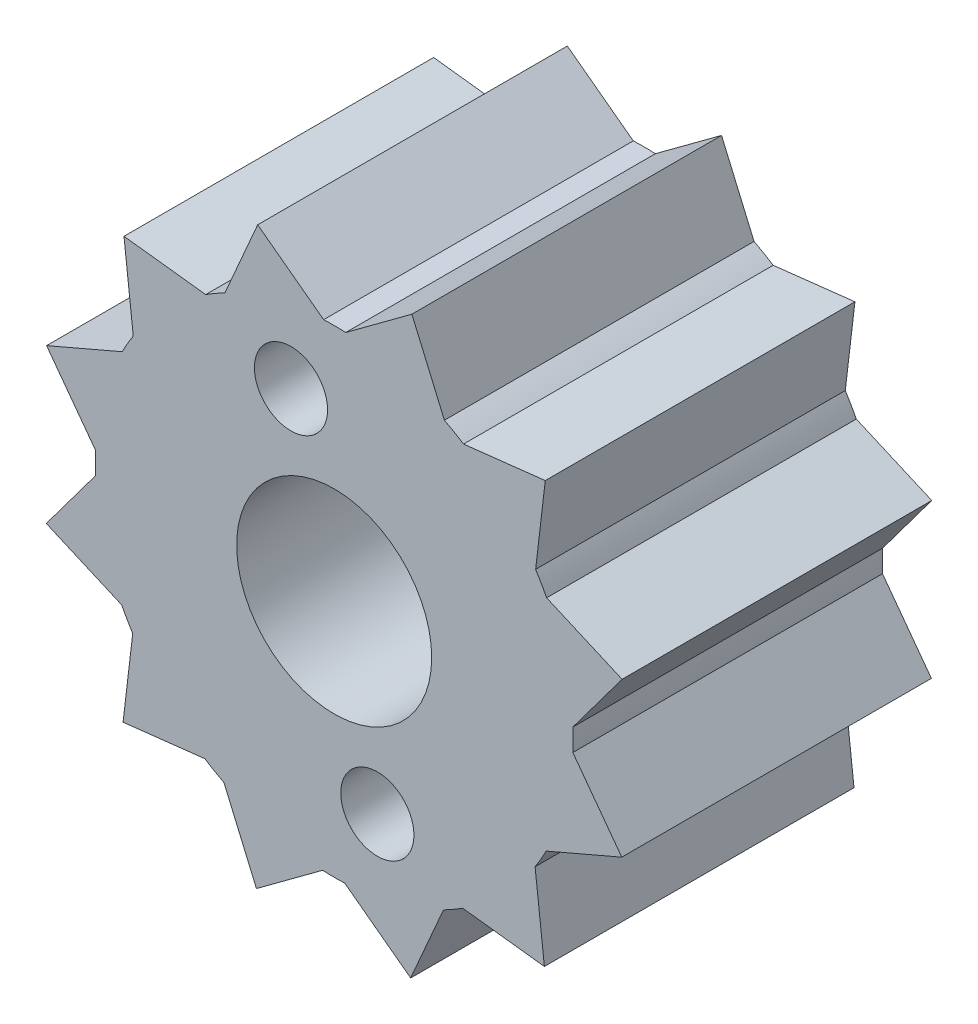
from build123d import *

# Parameters (mm, degrees)
SKETCH2_R           = 2
BOSS_EXTRUDE1_DEPTH = 6.35
SKETCH3_R           = 0.75
CUT_EXTRUDE1_DEPTH  = 11.490061241


with BuildPart() as part:
    # Sketch2 → Boss-Extrude1 (new body)
    with BuildSketch(Plane.XY):
        with BuildLine():
            Line((-5.904188549, -1.568559405), (-4.357072845, -2.241855531))
            ThreePointArc((-4.357072845, -2.241855531), (-4.248730253, -2.44096113), (-4.131295421, -2.634843097))
            Line((-4.131295421, -2.634843097), (-4.328897569, -4.310506566))
            Line((-4.328897569, -4.310506566), (-2.652408005, -4.120040264))
            ThreePointArc((-2.652408005, -4.120040264), (-2.459027768, -4.238299475), (-2.260385237, -4.347488767))
            Line((-2.260385237, -4.347488767), (-1.593681982, -5.897456974))
            Line((-1.593681982, -5.897456974), (-0.237032582, -4.894263536))
            ThreePointArc((-0.237032582, -4.894263536), (-0.010430778, -4.899988898), (0.216193347, -4.895228333))
            Line((0.216193347, -4.895228333), (1.568559405, -5.904188549))
            Line((1.568559405, -5.904188549), (2.241855531, -4.357072845))
            ThreePointArc((2.241855531, -4.357072845), (2.44096113, -4.248730253), (2.634843097, -4.131295421))
            Line((2.634843097, -4.131295421), (4.310506566, -4.328897569))
            Line((4.310506566, -4.328897569), (4.120040264, -2.652408005))
            ThreePointArc((4.120040264, -2.652408005), (4.238299475, -2.459027768), (4.347488767, -2.260385237))
            Line((4.347488767, -2.260385237), (5.897456974, -1.593681982))
            Line((5.897456974, -1.593681982), (4.894263536, -0.237032582))
            ThreePointArc((4.894263536, -0.237032582), (4.899988898, -0.010430778), (4.895228333, 0.216193347))
            Line((4.895228333, 0.216193347), (5.904188549, 1.568559405))
            Line((5.904188549, 1.568559405), (4.357072845, 2.241855531))
            ThreePointArc((4.357072845, 2.241855531), (4.248730253, 2.44096113), (4.131295421, 2.634843097))
            Line((4.131295421, 2.634843097), (4.328897569, 4.310506566))
            Line((4.328897569, 4.310506566), (2.652408005, 4.120040264))
            ThreePointArc((2.652408005, 4.120040264), (2.459027768, 4.238299475), (2.260385237, 4.347488767))
            Line((2.260385237, 4.347488767), (1.593681982, 5.897456974))
            Line((1.593681982, 5.897456974), (0.237032582, 4.894263536))
            ThreePointArc((0.237032582, 4.894263536), (0.010430778, 4.899988898), (-0.216193347, 4.895228333))
            Line((-0.216193347, 4.895228333), (-1.568559405, 5.904188549))
            Line((-1.568559405, 5.904188549), (-2.241855531, 4.357072845))
            ThreePointArc((-2.241855531, 4.357072845), (-2.44096113, 4.248730253), (-2.634843097, 4.131295421))
            Line((-2.634843097, 4.131295421), (-4.310506566, 4.328897569))
            Line((-4.310506566, 4.328897569), (-4.120040264, 2.652408005))
            ThreePointArc((-4.120040264, 2.652408005), (-4.238299475, 2.459027768), (-4.347488767, 2.260385237))
            Line((-4.347488767, 2.260385237), (-5.897456974, 1.593681982))
            Line((-5.897456974, 1.593681982), (-4.894263536, 0.237032582))
            ThreePointArc((-4.894263536, 0.237032582), (-4.899988898, 0.010430778), (-4.895228333, -0.216193347))
            Line((-4.895228333, -0.216193347), (-5.904188549, -1.568559405))
        make_face()
        Circle(SKETCH2_R, mode=Mode.SUBTRACT)
    extrude(amount=BOSS_EXTRUDE1_DEPTH)

    # Sketch3 → Cut-Extrude1 (cut, through all)
    with BuildSketch(Plane.XY.offset(6.35)):
        with Locations((-0.885829808, 3.334337348)):
            Circle(SKETCH3_R)
        with Locations((0.885829808, -3.334337348)):
            Circle(SKETCH3_R)
    extrude(amount=-CUT_EXTRUDE1_DEPTH, mode=Mode.SUBTRACT)


solid = part.part
